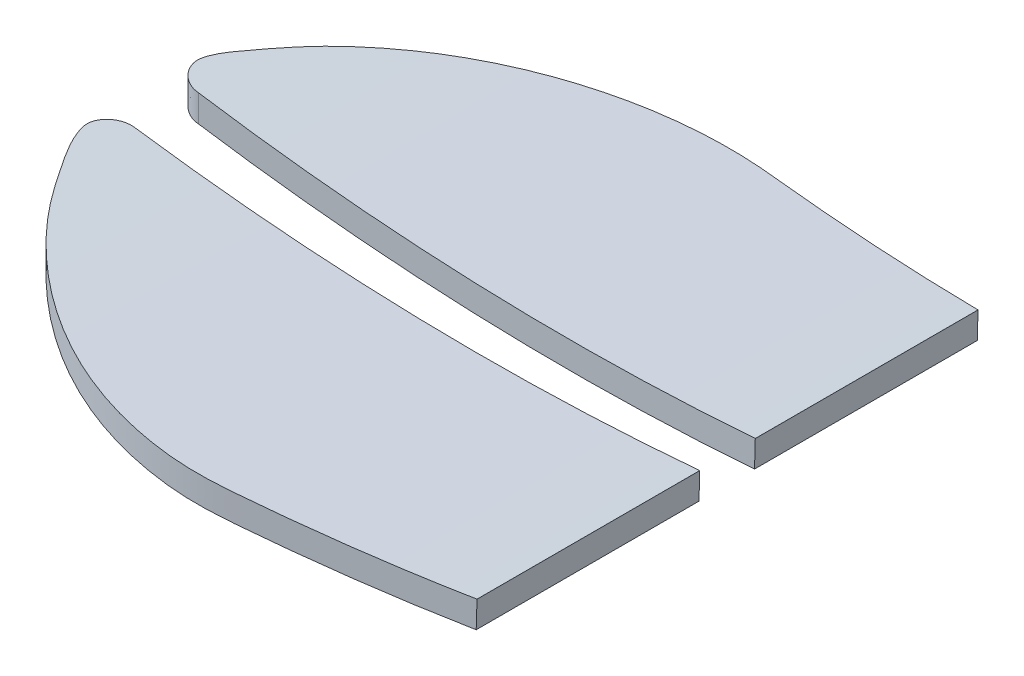
from build123d import *

# Parameters (mm, degrees)
Y_KSEKLIK_EKSTR_ZYON1_DEPTH = 55
KES_EKSTR_ZYON1_DEPTH       = 110
KES_EKSTR_ZYON1_DEPTH_BACK  = 110
IZIM5_OUTSIDE_W             = 86.532
IZIM5_OUTSIDE_H             = 137.038
KES_EKSTR_ZYON2_DEPTH       = 85


with BuildPart() as part:
    # Çizim1 → Yükseklik-Ekstrüzyon1 (new, symmetric)
    with BuildSketch(Plane.XY):
        with BuildLine():
            Line((-0.075010807, -2.715149048), (0, -0.007927797))
            Line((0, -0.007927797), (0, 0))
            ThreePointArc((0, 0), (-29.81394193, -0.66613641), (-59.494070389, 2.232974794))
            Line((-59.494070389, 2.232974794), (-59.494070389, -0.500375633))
            ThreePointArc((-59.494070389, -0.500375633), (-29.850101819, -3.366671884), (-0.075010807, -2.715149048))
        make_face()
    extrude(amount=Y_KSEKLIK_EKSTR_ZYON1_DEPTH, both=True)

    # Çizim5 outside → Kes-Ekstrüzyon1 (cut, two sides: drawn at the far end of the back side and taken through both)
    with BuildSketch(Plane(origin=(0, 0, 0), x_dir=(1, 0, 0), z_dir=(0, 1, 0)).offset(-KES_EKSTR_ZYON1_DEPTH_BACK)):
        with Locations((-29.747, 0)):
            Rectangle(IZIM5_OUTSIDE_W, IZIM5_OUTSIDE_H)
        with BuildLine():
            Line((-56.367778213, 4.175289019), (0, 4.175289019))
            Line((0, 4.175289019), (0, 29.891571186))
            Line((0, 29.891571186), (-21.719050446, 31.564533679))
            ThreePointArc((-21.719050446, 31.564533679), (-44.233404436, 26.124342722), (-59.257147448, 8.495418785))
            ThreePointArc((-59.257147448, 8.495418785), (-58.966430545, 5.563562545), (-56.367778213, 4.175289019))
        make_face(mode=Mode.SUBTRACT)
        with BuildLine():
            Line((0, 0.175289019), (-56.367778213, 0.175289019))
            ThreePointArc((-56.367778213, 0.175289019), (-58.966430545, -1.212984508), (-59.257147448, -4.144840747))
            ThreePointArc((-59.257147448, -4.144840747), (-44.233404436, -21.773764684), (-21.719050446, -27.213955641))
            Line((-21.719050446, -27.213955641), (0, -25.540993148))
            Line((0, -25.540993148), (0, 0.175289019))
        make_face(mode=Mode.SUBTRACT)
    extrude(amount=KES_EKSTR_ZYON1_DEPTH + KES_EKSTR_ZYON1_DEPTH_BACK, mode=Mode.SUBTRACT)


with BuildPart() as kes_ekstr_zyon1_piece_1:
    # of the separate pieces the step leaves, piece 1, a body of its own (kes_ekstr_zyon1_pieces)
    add(part.part.solids().sort_by_distance((-59.257147448, 2.195531635, 4.144840747))[0])


with BuildPart() as kes_ekstr_zyon1_piece_2:
    # of the separate pieces the step leaves, piece 2, a body of its own (kes_ekstr_zyon1_pieces)
    add(part.part.solids().sort_by_distance((-56.367778213, -0.970476736, -4.175289019))[0])


with BuildPart() as kes_ekstr_zyon2_tool:
    # Çizim6 → Kes-Ekstrüzyon2 (new body)
    with BuildSketch(Plane(origin=(726.739417183, 65.458593801, 18.923101675), x_dir=(0.9999981579386474, 0.0018893358023069587, -0.00033842213030479116), z_dir=(-0.0018893359104993415, 0.999998215203316, 1.5040198755781437e-14))):
        with BuildLine():
            Line((-783.431676214, 24.541668003), (-726.443128618, 24.184332875))
            Line((-726.443128618, 24.184332875), (-726.443128618, 21.898021943))
            Line((-726.443128618, 21.898021943), (-791.056713743, 21.898021943))
            Line((-791.056713743, 21.898021943), (-785.719763129, 49.974236192))
            Line((-785.719763129, 49.974236192), (-751.828590491, 55.555144448))
            Line((-751.828590491, 55.555144448), (-721.174036445, 52.76469032))
            Line((-721.174036445, 52.76469032), (-719.232850965, 52.76469032))
            Line((-719.232850965, 52.76469032), (-726.846038103, 46.67806977))
            add(Edge.make_bspline(
                [(-726.846038103, 46.67806977), (-728.917713328, 46.873841194), (-733.009623868, 47.261416612), (-738.755661636, 47.802948779), (-743.755306525, 48.280754422), (-747.65673984, 48.63664703), (-751.470461141, 49.036908133), (-755.427689943, 49.05413455), (-759.813867186, 48.503606814), (-764.620591456, 47.307827768), (-769.39369231, 45.336890239), (-773.718555811, 42.685589919), (-777.06135937, 40.017981239), (-779.666098716, 37.406385556), (-782.248102563, 34.282935289), (-784.129493211, 31.175818181), (-785.644880952, 28.579638683), (-786.248380484, 26.03043539), (-784.720147933, 24.466595222), (-783.431676214, 24.541668003)],
                knots=[0, 0, 0, 0, 0.086438892, 0.170734563, 0.239743535, 0.295063167, 0.33347469, 0.399004579, 0.458900989, 0.516648549, 0.604340468, 0.672157747, 0.726744912, 0.781613873, 0.825100263, 0.894754331, 0.932113893, 0.949968729, 1, 1, 1, 1], degree=3))
        make_face()
        with BuildLine():
            Line((-783.433801229, 18.262481863), (-726.203006278, 18.582598254))
            Line((-726.203006278, 18.582598254), (-726.203006278, 20.675011644))
            Line((-726.203006278, 20.675011644), (-791.056713743, 20.675011644))
            Line((-791.056713743, 20.675011644), (-791.056713743, -3.275472401))
            Line((-791.056713743, -3.275472401), (-754.818403754, -12.400962379))
            Line((-754.818403754, -12.400962379), (-721.903476312, -11.472341089))
            Line((-721.903476312, -11.472341089), (-726.795461561, -3.905858927))
            add(Edge.make_bspline(
                [(-726.795461561, -3.905858927), (-727.924060645, -4.01181398), (-729.695632513, -4.178132898), (-732.472620361, -4.43884164), (-735.027486768, -4.678699519), (-738.116691126, -4.968712482), (-741.551470823, -5.291214812), (-745.060070115, -5.620454021), (-748.78906427, -5.971037576), (-753.045851445, -6.367877269), (-758.741973283, -6.00632697), (-764.963438156, -4.49343769), (-770.85015535, -1.800785428), (-776.383130399, 1.991576748), (-780.832285573, 6.451071536), (-783.833453298, 11.072293732), (-785.526840385, 13.866997635), (-786.275108093, 16.709178662), (-784.787228217, 18.331868208), (-783.433801229, 18.262481863)],
                knots=[0, 0, 0, 0, 0.047075486, 0.07389483, 0.115832126, 0.1536428, 0.202749352, 0.259104908, 0.29997868, 0.358332327, 0.436430034, 0.535803311, 0.622504947, 0.703757482, 0.813443754, 0.881168705, 0.932322232, 0.948856003, 1, 1, 1, 1], degree=3))
        make_face()
    extrude(amount=-KES_EKSTR_ZYON2_DEPTH)


with BuildPart() as kes_ekstr_zyon1_piece_1_1:
    add(kes_ekstr_zyon1_piece_1.part)

    # Kes-Ekstrüzyon2: cut by kes_ekstr_zyon2_tool
    add(kes_ekstr_zyon2_tool.part, mode=Mode.SUBTRACT)


with BuildPart() as kes_ekstr_zyon1_piece_2_1:
    add(kes_ekstr_zyon1_piece_2.part)

    # Kes-Ekstrüzyon2: cut by kes_ekstr_zyon2_tool
    add(kes_ekstr_zyon2_tool.part, mode=Mode.SUBTRACT)


solid = Compound([kes_ekstr_zyon1_piece_1_1.part, kes_ekstr_zyon1_piece_2_1.part])
